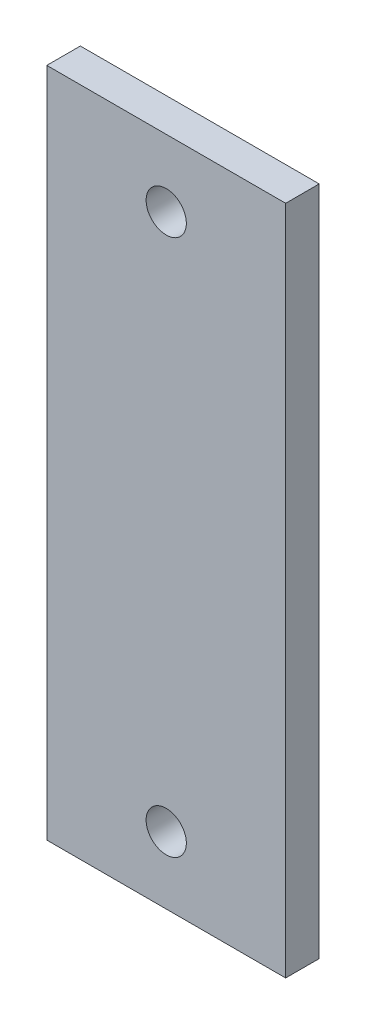
from build123d import *

# Parameters (mm, degrees)
SKETCH_1_W      = 17.8
SKETCH_1_H      = 50
SKETCH_1_R      = 1.5
EXTRUDE_1_DEPTH = 2.5


with BuildPart() as part:
    # 草图1 → 凸台-拉伸1 (new body)
    with BuildSketch(Plane.XY):
        Rectangle(SKETCH_1_W, SKETCH_1_H)
        with Locations((0, -20)):
            Circle(SKETCH_1_R, mode=Mode.SUBTRACT)
        with Locations((0, 20)):
            Circle(SKETCH_1_R, mode=Mode.SUBTRACT)
    extrude(amount=EXTRUDE_1_DEPTH)


solid = part.part
